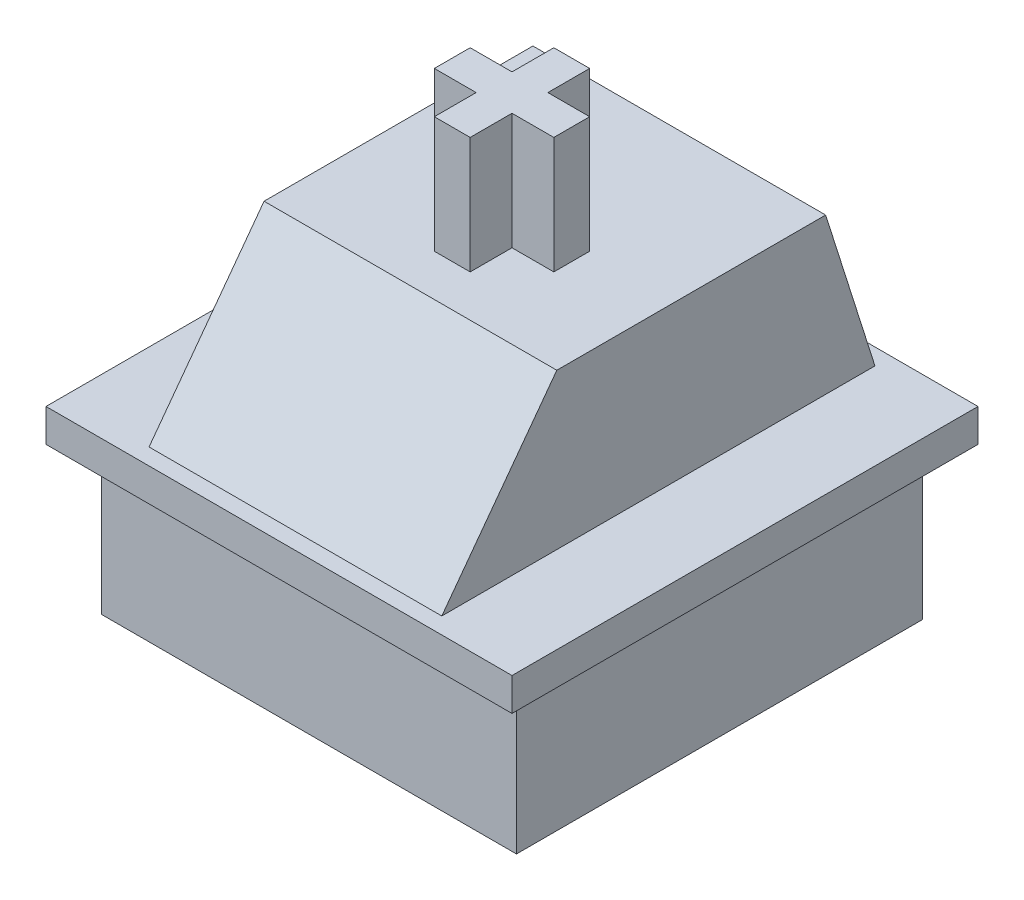
from build123d import *

# Parameters (mm, degrees)
SKETCH_4_W      = 15.6
SKETCH_4_H      = 15.6
EXTRUDE_1_DEPTH = 1.1
EXTRUDE_2_DEPTH = 4.9
SKETCH_7_W      = 13.9
SKETCH_7_H      = 13.6
EXTRUDE_4_DEPTH = 5
SKETCH_6_R      = 1.95
EXTRUDE_3_DEPTH = 3.3
SKETCH_8_W      = 1.2
SKETCH_8_H      = 4
SKETCH_8_W_2    = 4
SKETCH_8_H_2    = 1.2
EXTRUDE_5_DEPTH = 3.9
SKETCH_9_W      = 1
SKETCH_9_H      = 0.3
EXTRUDE_6_DEPTH = 3.8


with BuildPart() as part:
    # 草图4 → 凸台-拉伸1 (new body)
    with BuildSketch(Plane(origin=(0, 0, 0), x_dir=(1, 0, 0), z_dir=(0, 1, 0))):
        Rectangle(SKETCH_4_W, SKETCH_4_H)
    extrude(amount=EXTRUDE_1_DEPTH)

    # 草图5 → 凸台-拉伸2 (add, symmetric)
    with BuildSketch(Plane(origin=(0, 0, 0), x_dir=(0, 0, -1), z_dir=(1, 0, 0))):
        Polygon((-7.25, 1.1), (7.25, 1.1), (5.6, 6.3), (-3.4, 6.3), align=None)
    extrude(amount=EXTRUDE_2_DEPTH, both=True)

    # 草图7 → 凸台-拉伸4 (add)
    with BuildSketch(Plane.XZ):
        Rectangle(SKETCH_7_W, SKETCH_7_H)
    extrude(amount=EXTRUDE_4_DEPTH)

    # 草图6 → 凸台-拉伸3 (add)
    with BuildSketch(Plane.XZ.offset(5)):
        with Locations(Location((0, 0, 0), (0, 0, 270))):
            Circle(SKETCH_6_R)
    extrude(amount=EXTRUDE_3_DEPTH)

    # 草图8 → 凸台-拉伸5 (add)
    with BuildSketch(Plane(origin=(0, 6.3, 0), x_dir=(1, 0, 0), z_dir=(0, 1, 0))):
        Rectangle(SKETCH_8_W, SKETCH_8_H)
        Rectangle(SKETCH_8_W_2, SKETCH_8_H_2)
    extrude(amount=EXTRUDE_5_DEPTH)

    # 草图9 → 凸台-拉伸6 (add)
    with BuildSketch(Plane.XZ.offset(5)):
        with Locations((2.54, -5.01)):
            Rectangle(SKETCH_9_W, SKETCH_9_H)
        with Locations((-3.81, -2.54)):
            Rectangle(SKETCH_9_W, SKETCH_9_H)
    extrude(amount=EXTRUDE_6_DEPTH)


solid = part.part
